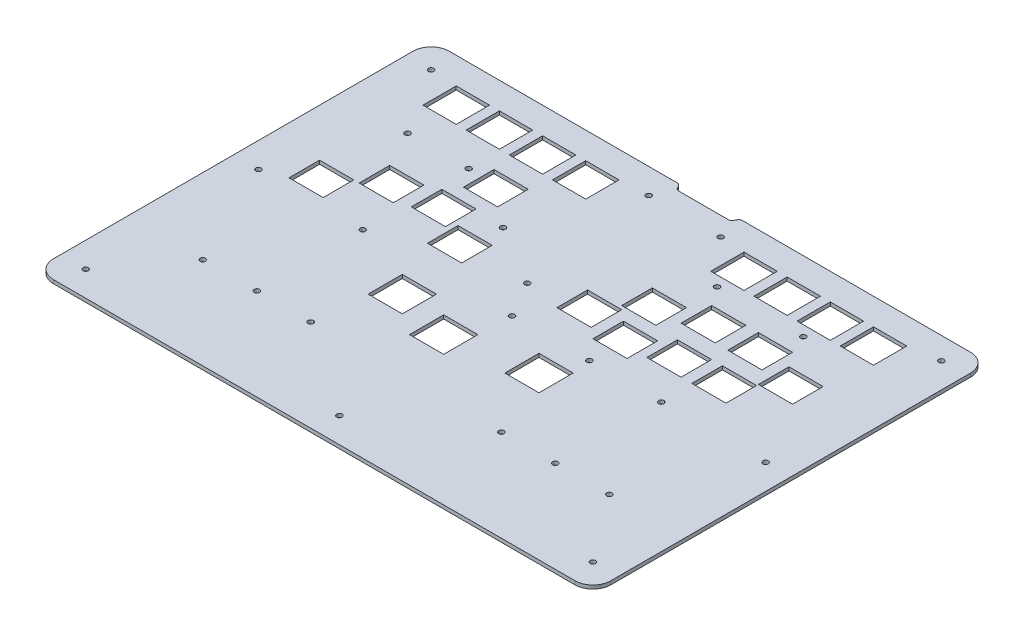
from build123d import *

# Parameters (mm, degrees)
SKETCH_1_R      = 1.5
SKETCH_1_W      = 18.5
SKETCH_1_H      = 18.5
SKETCH_1_W_2    = 19
SKETCH_1_H_2    = 17
SKETCH_1_H_3    = 19
EXTRUDE_1_DEPTH = 2


with BuildPart() as part:
    # 草图1 → 凸台-拉伸1 (new body)
    with BuildSketch(Plane(origin=(0, 0, 0), x_dir=(1, 0, 0), z_dir=(0, 1, 0))):
        with BuildLine():
            Line((10, 0), (136.884360712, 0))
            ThreePointArc((136.884360712, 0), (137.900113715, -0.277140216), (138.634360712, -1.031754163))
            Line((138.634360712, -1.031754163), (139.429147615, -2.468245837))
            ThreePointArc((139.429147615, -2.468245837), (140.163394612, -3.222859784), (141.179147615, -3.5))
            Line((141.179147615, -3.5), (143.5, -3.5))
            Line((143.5, -3.5), (166.5, -3.5))
            Line((166.5, -3.5), (168.820852385, -3.5))
            ThreePointArc((168.820852385, -3.5), (169.836605388, -3.222859784), (170.570852385, -2.468245837))
            Line((170.570852385, -2.468245837), (171.365639288, -1.031754163))
            ThreePointArc((171.365639288, -1.031754163), (172.099886285, -0.277140216), (173.115639288, 0))
            Line((173.115639288, 0), (300, 0))
            ThreePointArc((300, 0), (307.071067812, -2.928932188), (310, -10))
            Line((310, -10), (310, -210))
            ThreePointArc((310, -210), (307.071067812, -217.071067812), (300, -220))
            Line((300, -220), (10, -220))
            ThreePointArc((10, -220), (2.928932188, -217.071067812), (0, -210))
            Line((0, -210), (0, -10))
            ThreePointArc((0, -10), (2.928932188, -2.928932188), (10, 0))
        make_face()
        with Locations(Location((14, -14, 0), (0, 0, 270))):
            Circle(SKETCH_1_R, mode=Mode.SUBTRACT)
        with Locations(Location((14, -206, 0), (0, 0, 270))):
            Circle(SKETCH_1_R, mode=Mode.SUBTRACT)
        with Locations(Location((296, -206, 0), (0, 0, 270))):
            Circle(SKETCH_1_R, mode=Mode.SUBTRACT)
        with Locations(Location((296, -12.28568254, 0), (0, 0, 270))):
            Circle(SKETCH_1_R, mode=Mode.SUBTRACT)
        with Locations(Location((155, -206, 0), (0, 0, 270))):
            Circle(SKETCH_1_R, mode=Mode.SUBTRACT)
        with Locations(Location((175, -14, 0), (0, 0, 270))):
            Circle(SKETCH_1_R, mode=Mode.SUBTRACT)
        with Locations(Location((135, -14, 0), (0, 0, 270))):
            Circle(SKETCH_1_R, mode=Mode.SUBTRACT)
        with Locations(Location((296, -110, 0), (0, 0, 270))):
            Circle(SKETCH_1_R, mode=Mode.SUBTRACT)
        with Locations(Location((14, -110, 0), (0, 0, 270))):
            Circle(SKETCH_1_R, mode=Mode.SUBTRACT)
        with Locations(Location((155, -110, 0), (0, 0, 270))):
            Circle(SKETCH_1_R, mode=Mode.SUBTRACT)
        with Locations(Location((72, -110, 0), (0, 0, 270))):
            Circle(SKETCH_1_R, mode=Mode.SUBTRACT)
        with Locations(Location((72, -168.903225806, 0), (0, 0, 270))):
            Circle(SKETCH_1_R, mode=Mode.SUBTRACT)
        with Locations(Location((72, -51.096774194, 0), (0, 0, 270))):
            Circle(SKETCH_1_R, mode=Mode.SUBTRACT)
        with Locations(Location((42, -168.903225806, 0), (0, 0, 270))):
            Circle(SKETCH_1_R, mode=Mode.SUBTRACT)
        with Locations(Location((102, -168.903225806, 0), (0, 0, 270))):
            Circle(SKETCH_1_R, mode=Mode.SUBTRACT)
        with Locations(Location((238, -110, 0), (0, 0, 270))):
            Circle(SKETCH_1_R, mode=Mode.SUBTRACT)
        with Locations(Location((238, -168.903225806, 0), (0, 0, 270))):
            Circle(SKETCH_1_R, mode=Mode.SUBTRACT)
        with Locations(Location((268, -168.903225806, 0), (0, 0, 270))):
            Circle(SKETCH_1_R, mode=Mode.SUBTRACT)
        with Locations(Location((208, -168.903225806, 0), (0, 0, 270))):
            Circle(SKETCH_1_R, mode=Mode.SUBTRACT)
        with Locations(Location((246, -39, 0), (0, 0, 270))):
            Circle(SKETCH_1_R, mode=Mode.SUBTRACT)
        with Locations(Location((198, -39, 0), (0, 0, 270))):
            Circle(SKETCH_1_R, mode=Mode.SUBTRACT)
        with Locations(Location((110, -70, 0), (0, 0, 270))):
            Circle(SKETCH_1_R, mode=Mode.SUBTRACT)
        with Locations(Location((38, -51.096774194, 0), (0, 0, 270))):
            Circle(SKETCH_1_R, mode=Mode.SUBTRACT)
        with Locations(Location((198, -110, 0), (0, 0, 270))):
            Circle(SKETCH_1_R, mode=Mode.SUBTRACT)
        with Locations(Location((143.5, -90, 0), (0, 0, 270))):
            Circle(SKETCH_1_R, mode=Mode.SUBTRACT)
        with Locations((38, -24)):
            Rectangle(SKETCH_1_W, SKETCH_1_H, mode=Mode.SUBTRACT)
        with Locations((62, -24)):
            Rectangle(SKETCH_1_W, SKETCH_1_H, mode=Mode.SUBTRACT)
        with Locations((86, -24)):
            Rectangle(SKETCH_1_W, SKETCH_1_H, mode=Mode.SUBTRACT)
        with Locations((110, -24)):
            Rectangle(SKETCH_1_W, SKETCH_1_H, mode=Mode.SUBTRACT)
        with Locations((198, -24)):
            Rectangle(SKETCH_1_W, SKETCH_1_H, mode=Mode.SUBTRACT)
        with Locations((222, -24)):
            Rectangle(SKETCH_1_W, SKETCH_1_H, mode=Mode.SUBTRACT)
        with Locations((246, -24)):
            Rectangle(SKETCH_1_W, SKETCH_1_H, mode=Mode.SUBTRACT)
        with Locations((270, -24)):
            Rectangle(SKETCH_1_W, SKETCH_1_H, mode=Mode.SUBTRACT)
        with Locations((89, -53)):
            Rectangle(SKETCH_1_W_2, SKETCH_1_H_2, mode=Mode.SUBTRACT)
        with Locations((84, -77)):
            Rectangle(SKETCH_1_W_2, SKETCH_1_H_2, mode=Mode.SUBTRACT)
        with Locations((106, -90)):
            Rectangle(SKETCH_1_W_2, SKETCH_1_H_2, mode=Mode.SUBTRACT)
        with Locations((58, -80)):
            Rectangle(SKETCH_1_W_2, SKETCH_1_H_2, mode=Mode.SUBTRACT)
        with Locations((36, -97)):
            Rectangle(SKETCH_1_W_2, SKETCH_1_H_2, mode=Mode.SUBTRACT)
        with Locations((114, -130)):
            Rectangle(SKETCH_1_W_2, SKETCH_1_H_3, mode=Mode.SUBTRACT)
        with Locations((145, -138)):
            Rectangle(SKETCH_1_W_2, SKETCH_1_H_3, mode=Mode.SUBTRACT)
        with Locations((190, -130)):
            Rectangle(SKETCH_1_W_2, SKETCH_1_H_3, mode=Mode.SUBTRACT)
        with Locations((173, -85)):
            Rectangle(SKETCH_1_W_2, SKETCH_1_H_2, mode=Mode.SUBTRACT)
        with Locations((190, -66)):
            Rectangle(SKETCH_1_W_2, SKETCH_1_H_2, mode=Mode.SUBTRACT)
        with Locations((198, -90)):
            Rectangle(SKETCH_1_W_2, SKETCH_1_H_2, mode=Mode.SUBTRACT)
        with Locations((215, -58)):
            Rectangle(SKETCH_1_W_2, SKETCH_1_H_2, mode=Mode.SUBTRACT)
        with Locations((222, -84)):
            Rectangle(SKETCH_1_W_2, SKETCH_1_H_2, mode=Mode.SUBTRACT)
        with Locations((241, -58)):
            Rectangle(SKETCH_1_W_2, SKETCH_1_H_2, mode=Mode.SUBTRACT)
        with Locations((247, -84)):
            Rectangle(SKETCH_1_W_2, SKETCH_1_H_2, mode=Mode.SUBTRACT)
        with Locations((266, -66)):
            Rectangle(SKETCH_1_W_2, SKETCH_1_H_2, mode=Mode.SUBTRACT)
    extrude(amount=EXTRUDE_1_DEPTH)


solid = part.part
